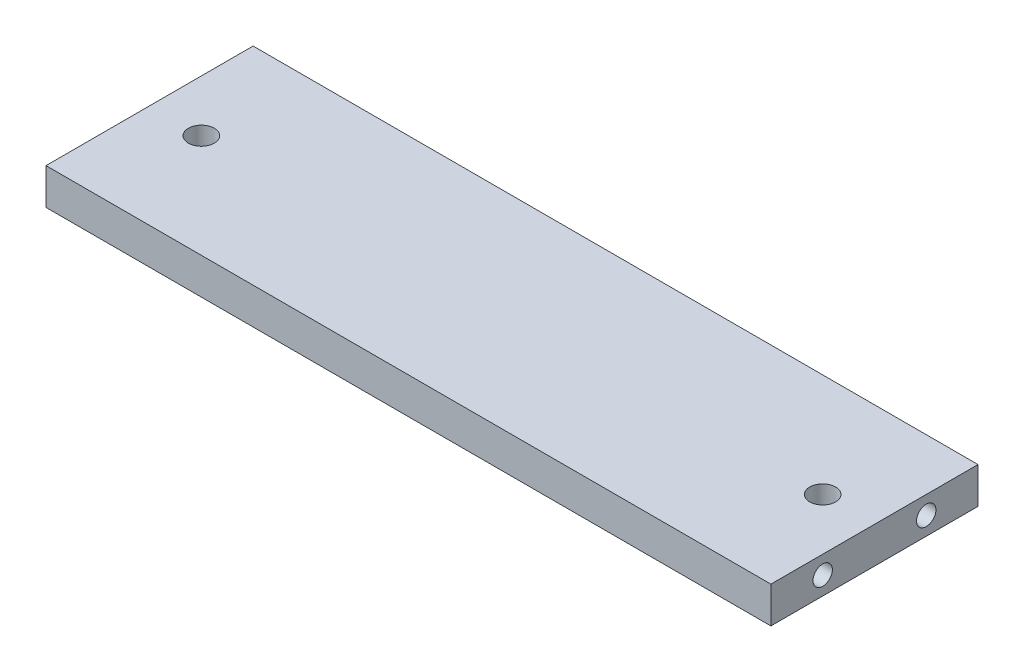
from build123d import *

# Parameters (mm, degrees)
SKETCH1_W           = 88.9
SKETCH1_H           = 25.4
BOSS_EXTRUDE1_DEPTH = 4.445
SKETCH3_R           = 1.190625
CUT_EXTRUDE2_DEPTH  = 9.525
SKETCH4_R           = 1.5875
CUT_EXTRUDE3_DEPTH  = 93.564183273


with BuildPart() as part:
    # Sketch1 → Boss-Extrude1 (new body)
    with BuildSketch(Plane(origin=(0, 0, 0), x_dir=(1, 0, 0), z_dir=(0, 1, 0))):
        with Locations((44.45, 12.7)):
            Rectangle(SKETCH1_W, SKETCH1_H)
    extrude(amount=BOSS_EXTRUDE1_DEPTH)

    # Sketch3 → Cut-Extrude2 (cut)
    with BuildSketch(Plane(origin=(88.9, 0, 0), x_dir=(0, 0, -1), z_dir=(1, 0, 0))):
        with Locations((19.05, 2.2225)):
            Circle(SKETCH3_R)
        with Locations((6.35, 2.2225)):
            Circle(SKETCH3_R)
    extrude(amount=-CUT_EXTRUDE2_DEPTH, mode=Mode.SUBTRACT)

    # Sketch4 → Cut-Extrude3 (cut, through all)
    with BuildSketch(Plane(origin=(0, 4.445, 0), x_dir=(1, 0, 0), z_dir=(0, 1, 0))):
        with Locations(Location((6.35, 12.7, 0), (0, 0, 270))):
            Circle(SKETCH4_R)
        with Locations(Location((82.55, 12.7, 0), (0, 0, 270))):
            Circle(SKETCH4_R)
    extrude(amount=-CUT_EXTRUDE3_DEPTH, mode=Mode.SUBTRACT)


solid = part.part
